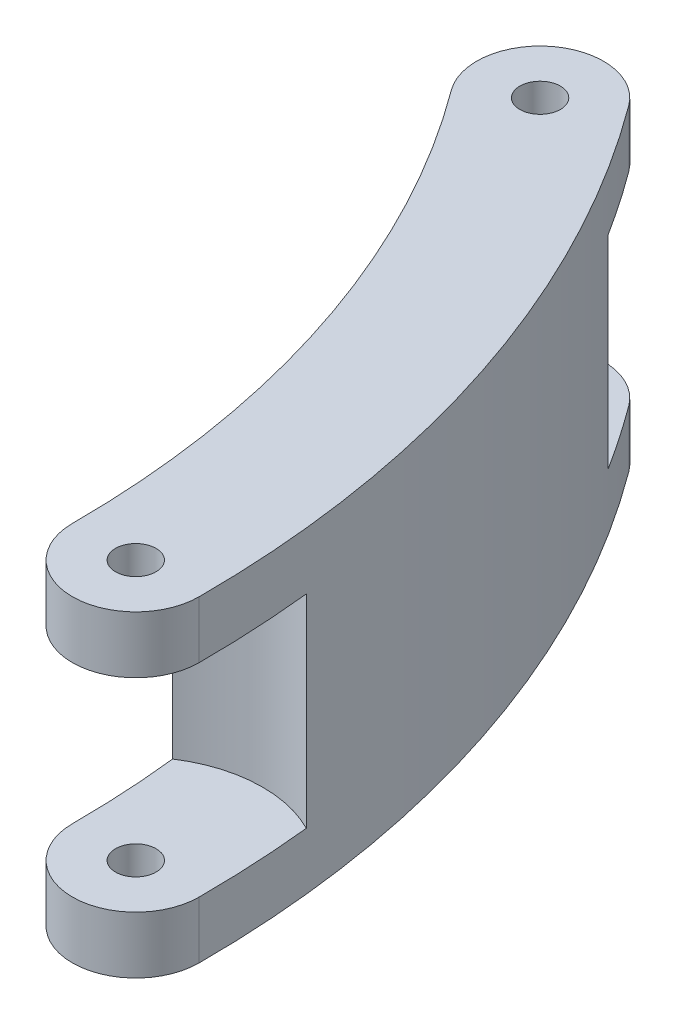
from build123d import *

# Parameters (mm, degrees)
EXTRUDE_1_DEPTH          = 12.5
SKETCH_2_R               = 10
CUT_EXTRUDE_1_DEPTH      = 8
CUT_EXTRUDE_2_DEPTH      = 103.984553477
CUT_EXTRUDE_2_DEPTH_BACK = 103.984553477
SKETCH_3_R               = 1.6


with BuildPart() as part:
    # 草图1 → 凸台-拉伸1 (new, symmetric)
    with BuildSketch(Plane(origin=(0, 0, 0), x_dir=(1, 0, 0), z_dir=(0, 1, 0))):
        with BuildLine():
            ThreePointArc((60.351562504, 44.527394976), (71.243831971, 23.437499997), (75, 0))
            ThreePointArc((75, 0), (80, -5), (85, 0))
            ThreePointArc((85, 0), (80.743009566, 26.5625), (68.3984375, 50.464380979))
            ThreePointArc((68.3984375, 50.464380979), (61.406506999, 51.519325478), (60.351562504, 44.527394976))
        make_face()
    extrude(amount=EXTRUDE_1_DEPTH, both=True)

    # 草图2 → 切除-拉伸1 (cut, symmetric)
    with BuildSketch(Plane(origin=(0, 0, 0), x_dir=(1, 0, 0), z_dir=(0, 1, 0))):
        with Locations((80, 0)):
            Circle(SKETCH_2_R)
        with BuildLine():
            Line((73.420566464, 38.244601007), (66.808461169, 34.082686459))
            ThreePointArc((66.808461169, 34.082686459), (63.794128955, 39.437407507), (60.351562504, 44.527394976))
            ThreePointArc((60.351562504, 44.527394976), (61.406506999, 51.519325478), (68.3984375, 50.464380979))
            ThreePointArc((68.3984375, 50.464380979), (70.215090022, 47.904500135), (71.935985524, 45.279288717))
            Line((71.935985524, 45.279288717), (73.420566464, 38.244601007))
        make_face()
    extrude(amount=CUT_EXTRUDE_1_DEPTH, both=True, mode=Mode.SUBTRACT)

    # 草图3 → 切除-拉伸2 (cut, two sides: drawn at the far end of the back side and taken through both)
    with BuildSketch(Plane(origin=(0, 12.5, 0), x_dir=(1, 0, 0), z_dir=(0, 1, 0)).offset(-CUT_EXTRUDE_2_DEPTH_BACK)):
        with Locations(Location((64.375, 47.49588798, 0), (0, 0, 270))):
            Circle(SKETCH_3_R)
        with Locations(Location((80, 0, 0), (0, 0, 270))):
            Circle(SKETCH_3_R)
    extrude(amount=CUT_EXTRUDE_2_DEPTH + CUT_EXTRUDE_2_DEPTH_BACK, mode=Mode.SUBTRACT)


solid = part.part
